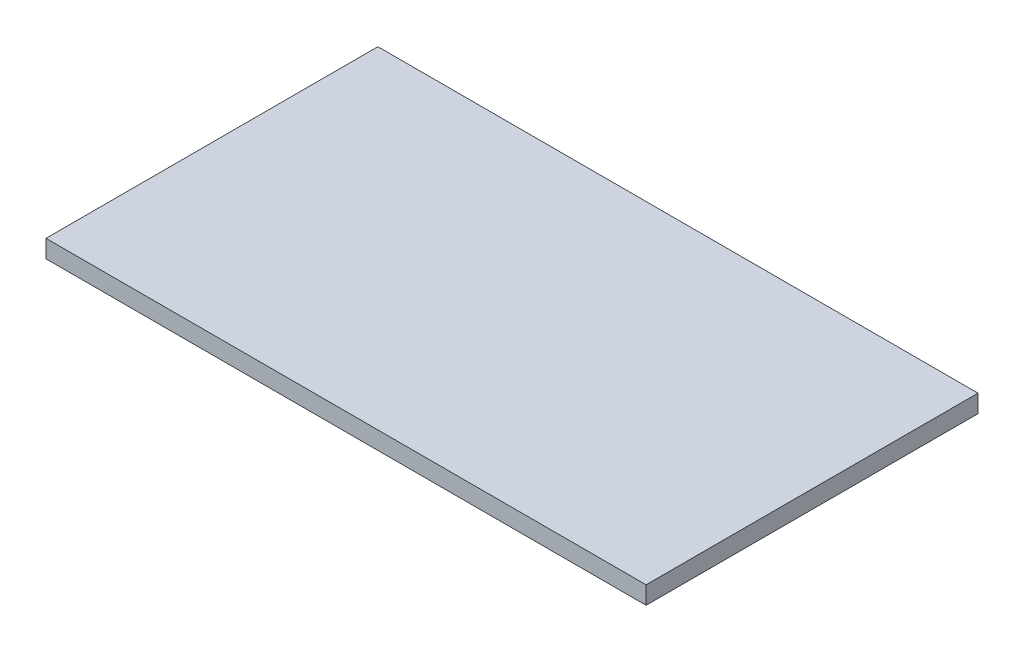
from build123d import *

# Parameters (mm, degrees)
SKETCH1_W           = 642.9375
SKETCH1_H           = 355.6
BOSS_EXTRUDE1_DEPTH = 19.05


with BuildPart() as part:
    # Sketch1 → Boss-Extrude1 (new body)
    with BuildSketch(Plane(origin=(0, 0, 0), x_dir=(1, 0, 0), z_dir=(0, 1, 0))):
        Rectangle(SKETCH1_W, SKETCH1_H)
    extrude(amount=BOSS_EXTRUDE1_DEPTH)


solid = part.part
